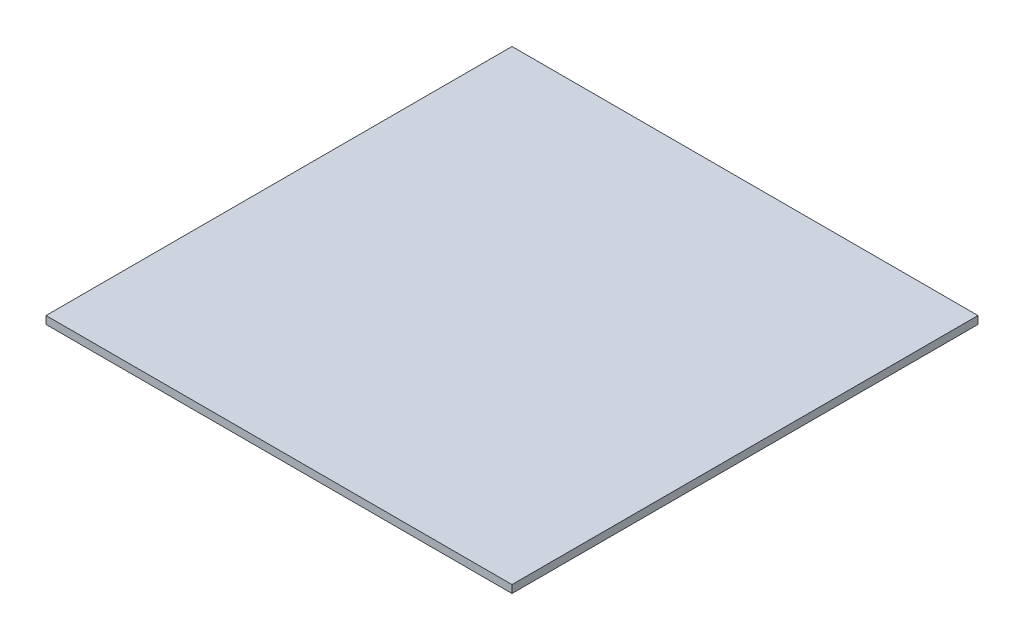
from build123d import *

# Parameters (mm, degrees)
SKETCH_1_W      = 300
SKETCH_1_H      = 300
EXTRUDE_1_DEPTH = 5


with BuildPart() as part:
    # 草图1 → 凸台-拉伸1 (new body)
    with BuildSketch(Plane(origin=(0, 0, 0), x_dir=(1, 0, 0), z_dir=(0, 1, 0))):
        Rectangle(SKETCH_1_W, SKETCH_1_H)
    extrude(amount=EXTRUDE_1_DEPTH)


solid = part.part
